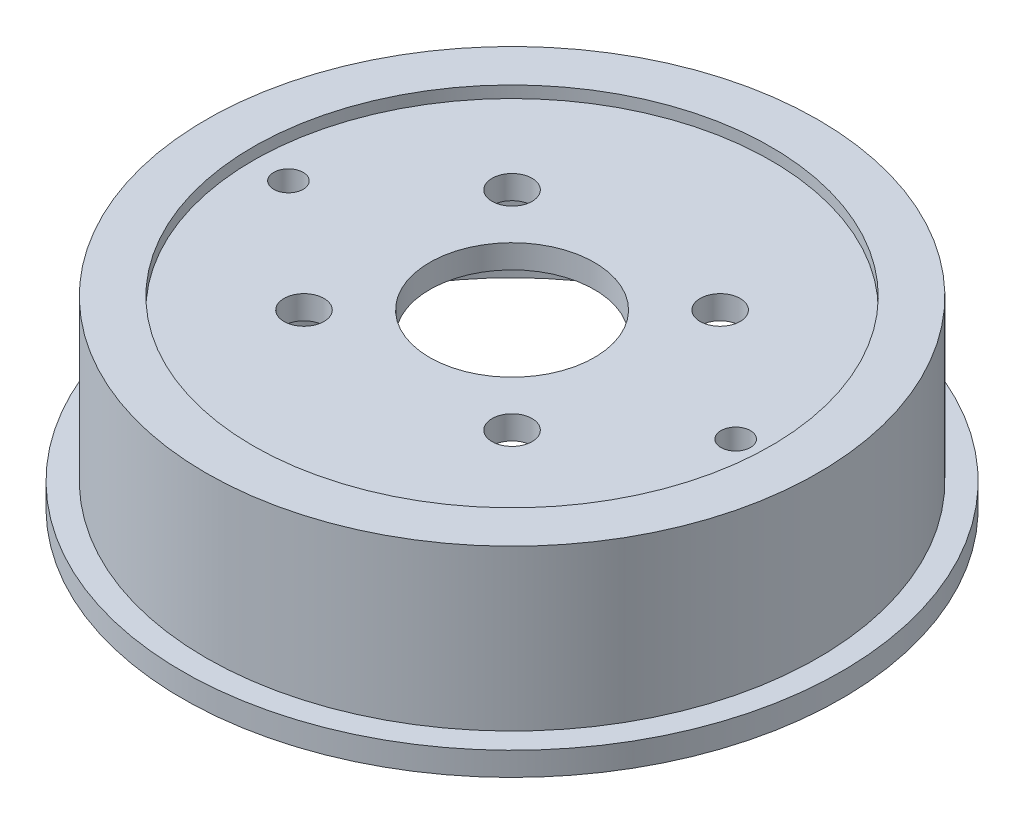
from build123d import *

# Parameters (mm, degrees)
SKETCH_1_R          = 26
SKETCH_1_R_2        = 24
EXTRUDE_1_DEPTH     = 12.6
EXTRUDE_START       = -2
SKETCH_2_R          = 28
SKETCH_2_R_2        = 26
EXTRUDE_2_DEPTH     = 2
SKETCH_3_R          = 26
EXTRUDE_3_DEPTH     = 2
SKETCH_4_R          = 26
SKETCH_4_R_2        = 22
EXTRUDE_4_DEPTH     = 1
EXTRUDE_START_2     = 11
EXTRUDE_5_DEPTH     = 11
M3X0_51_D           = 2.5
SKETCH_8_R          = 7
CUT_EXTRUDE_1_DEPTH = 2
HOLE_WIZARD_M31_D   = 3.4


with BuildPart() as part:
    # Эскиз1 → Бобышка-Вытянуть1 (new body)
    with BuildSketch(Plane(origin=(0, 0, 0), x_dir=(1, 0, 0), z_dir=(0, 1, 0))):
        with Locations(Location((0, 0, 0), (0, 0, 270))):
            Circle(SKETCH_1_R)
        with Locations(Location((0, 0, 0), (0, 0, 270))):
            Circle(SKETCH_1_R_2, mode=Mode.SUBTRACT)
    extrude(amount=EXTRUDE_1_DEPTH)

    # Эскиз2 → Бобышка-Вытянуть2 (add)
    with BuildSketch(Plane.XZ.offset(EXTRUDE_START)):
        with Locations(Location((0, 0, 0), (0, 0, 270))):
            Circle(SKETCH_2_R)
        with Locations(Location((0, 0, 0), (0, 0, 270))):
            Circle(SKETCH_2_R_2, mode=Mode.SUBTRACT)
    extrude(amount=EXTRUDE_2_DEPTH)

    # Эскиз3 → Бобышка-Вытянуть3 (add)
    with BuildSketch(Plane(origin=(0, 12.6, 0), x_dir=(1, 0, 0), z_dir=(0, 1, 0))):
        with Locations(Location((0, 0, 0), (0, 0, 90))):
            Circle(SKETCH_3_R)
    extrude(amount=EXTRUDE_3_DEPTH)

    # Эскиз4 → Бобышка-Вытянуть4 (add)
    with BuildSketch(Plane(origin=(0, 14.6, 0), x_dir=(1, 0, 0), z_dir=(0, 1, 0))):
        with Locations(Location((0, 0, 0), (0, 0, 90))):
            Circle(SKETCH_4_R)
        with Locations(Location((0, 0, 0), (0, 0, 270))):
            Circle(SKETCH_4_R_2, mode=Mode.SUBTRACT)
    extrude(amount=EXTRUDE_4_DEPTH)

    # Эскиз5 → Бобышка-Вытянуть5 (add)
    with BuildSketch(Plane.XZ.offset(-12.6).offset(EXTRUDE_START_2)):
        with BuildLine():
            Line((19, 3.5), (23.743420141, 3.5))
            ThreePointArc((23.743420141, 3.5), (24, 0), (23.743420141, -3.5))
            Line((23.743420141, -3.5), (19, -3.5))
            ThreePointArc((19, -3.5), (15.5, 0), (19, 3.5))
        make_face()
        with BuildLine():
            Line((-19, -3.5), (-23.743420141, -3.5))
            ThreePointArc((-23.743420141, -3.5), (-24, 0), (-23.743420141, 3.5))
            Line((-23.743420141, 3.5), (-19, 3.5))
            ThreePointArc((-19, 3.5), (-15.5, 0), (-19, -3.5))
        make_face()
    extrude(amount=-EXTRUDE_5_DEPTH)

    # Отверстие обработанное метчиком M3x0.51 (through all)
    with Locations(Plane(origin=(0, 1.6, 0), x_dir=(-1, 0, 0), z_dir=(0, -1, 0))):
        with Locations((-19, 0), (19, 0)):
            Hole(M3X0_51_D / 2)

    # Эскиз8 → Вырез-Вытянуть1 (cut)
    with BuildSketch(Plane(origin=(0, 14.6, 0), x_dir=(1, 0, 0), z_dir=(0, 1, 0))):
        with Locations(Location((0, 0, 0), (0, 0, 270))):
            Circle(SKETCH_8_R)
    extrude(amount=-CUT_EXTRUDE_1_DEPTH, mode=Mode.SUBTRACT)

    # Отверстие с зазором M31 (through all)
    with Locations(Plane(origin=(0, 14.6, 0), x_dir=(1, 0, 0), z_dir=(0, 1, 0))):
        with Locations((-8.838834765, 8.838834765), (8.838834765, 8.838834765), (8.838834765, -8.838834765), (-8.838834765, -8.838834765)):
            Hole(HOLE_WIZARD_M31_D / 2)


solid = part.part
